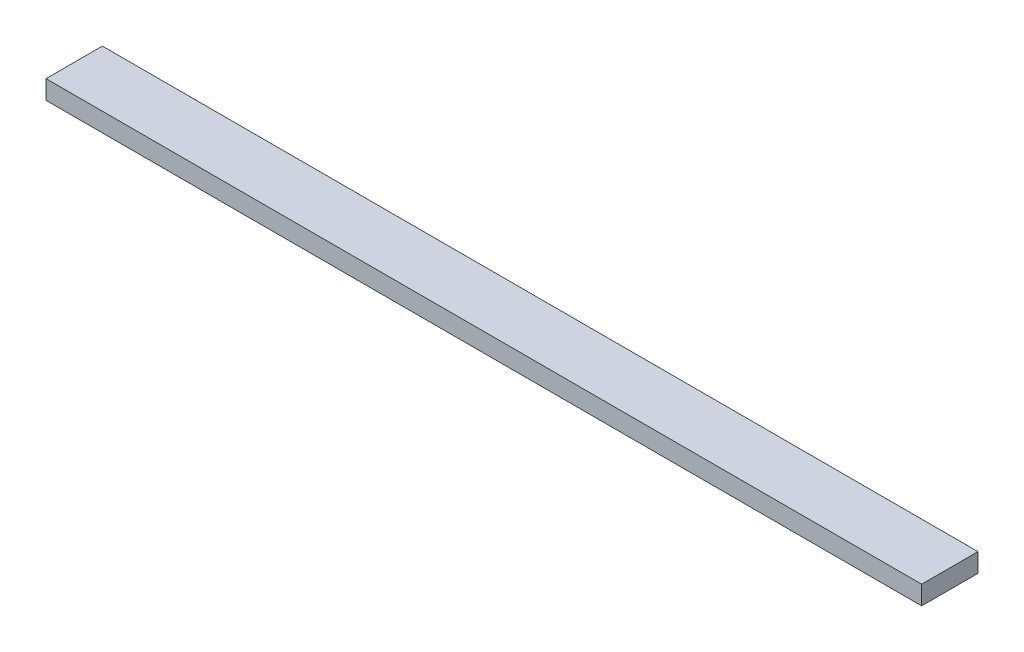
from build123d import *

# Parameters (mm, degrees)
SKETCH1_W           = 2330
SKETCH1_H           = 150
BOSS_EXTRUDE1_DEPTH = 50


with BuildPart() as part:
    # Sketch1 → Boss-Extrude1 (new body)
    with BuildSketch(Plane(origin=(0, 0, 0), x_dir=(1, 0, 0), z_dir=(0, 1, 0))):
        with Locations((1165, 75)):
            Rectangle(SKETCH1_W, SKETCH1_H)
    extrude(amount=BOSS_EXTRUDE1_DEPTH)


solid = part.part
